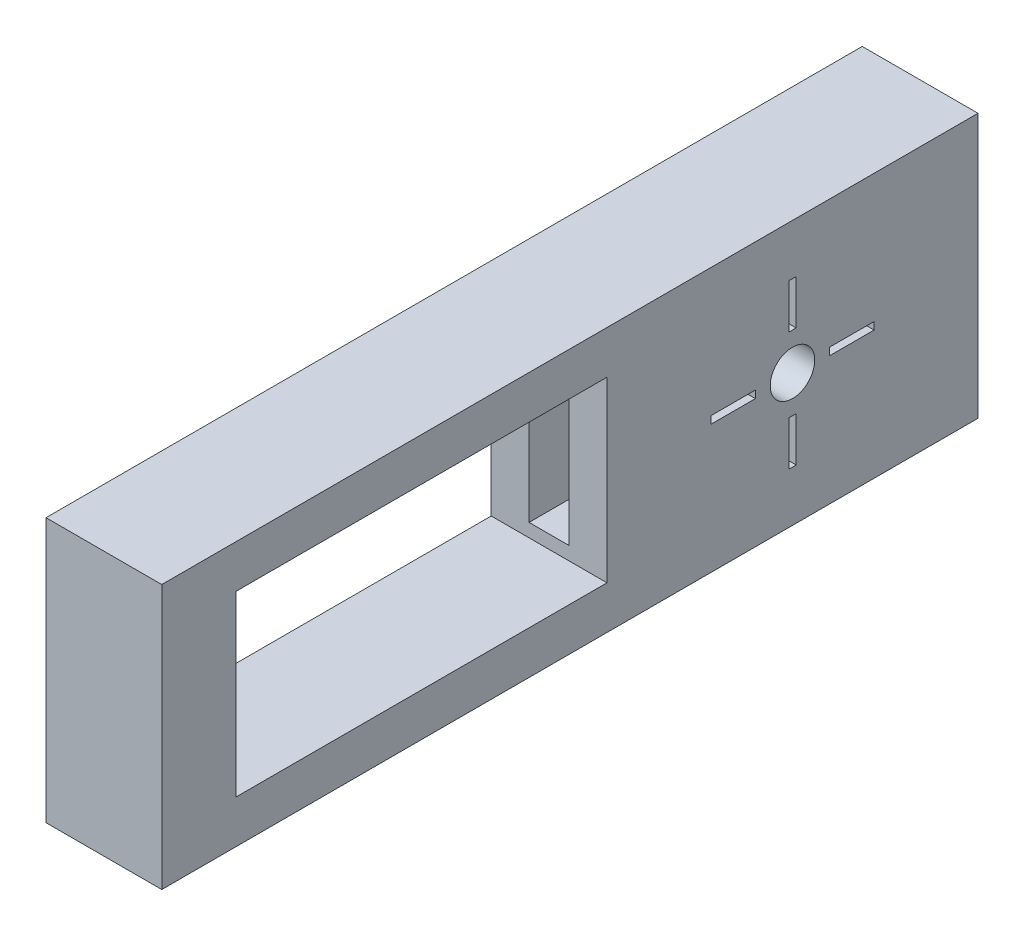
from build123d import *

# Parameters (mm, degrees)
SKETCH1_W           = 17.8
SKETCH1_H           = 25
SKETCH1_R           = 1.5
BOSS_EXTRUDE1_DEPTH = 3.9
SKETCH3_W           = 0.5
SKETCH3_H           = 3
CUT_EXTRUDE1_DEPTH  = 10
CIRPATTERN1_COUNT   = 4
SKETCH4_W           = 2.7
SKETCH4_H           = 10.2
CUT_EXTRUDE2_DEPTH  = 18
SKETCH5_W           = 2.8
SKETCH5_H           = 9
CUT_EXTRUDE3_DEPTH  = 10
SKETCH6_W           = 7.8
SKETCH6_H           = 17.8
BOSS_EXTRUDE2_DEPTH = 30
SKETCH7_W           = 25
SKETCH7_H           = 12
CUT_EXTRUDE4_DEPTH  = 30


with BuildPart() as part:
    # Sketch1 → Boss-Extrude1 (new, symmetric)
    with BuildSketch(Plane.YZ):
        Rectangle(SKETCH1_W, SKETCH1_H)
        with Locations(Location((0, 0, 0), (0, 0, 270))):
            Circle(SKETCH1_R, mode=Mode.SUBTRACT)
    extrude(amount=BOSS_EXTRUDE1_DEPTH, both=True)

    # Sketch3 → Cut-Extrude1 (cut)
    with BuildSketch(Plane(origin=(3.9, 0, 0), x_dir=(0, 0, -1), z_dir=(1, 0, 0))):
        with Locations((0, 4)):
            Rectangle(SKETCH3_W, SKETCH3_H)
    cut_extrude1 = extrude(amount=-CUT_EXTRUDE1_DEPTH, mode=Mode.SUBTRACT)

    # CirPattern1: Cut-Extrude1 ×4 about axis
    cirpattern1_axis = Axis((0, 0, 0), (1, 0, 0))
    for i in range(1, CIRPATTERN1_COUNT):
        add(cut_extrude1.rotate(cirpattern1_axis, i * 360 / CIRPATTERN1_COUNT), mode=Mode.SUBTRACT)

    # Sketch4 → Cut-Extrude2 (cut)
    with BuildSketch(Plane.XY.offset(12.5)):
        Rectangle(SKETCH4_W, SKETCH4_H)
    extrude(amount=-CUT_EXTRUDE2_DEPTH, mode=Mode.SUBTRACT)

    # Sketch5 → Cut-Extrude3 (cut)
    with BuildSketch(Plane(origin=(0, 0, -12.5), x_dir=(-1, 0, 0), z_dir=(0, 0, -1))):
        Rectangle(SKETCH5_W, SKETCH5_H)
    extrude(amount=-CUT_EXTRUDE3_DEPTH, mode=Mode.SUBTRACT)

    # Sketch6 → Boss-Extrude2 (add)
    with BuildSketch(Plane.XY.offset(12.5)):
        Rectangle(SKETCH6_W, SKETCH6_H)
    extrude(amount=BOSS_EXTRUDE2_DEPTH)

    # Sketch7 → Cut-Extrude4 (cut)
    with BuildSketch(Plane(origin=(3.9, 0, 0), x_dir=(0, 0, -1), z_dir=(1, 0, 0))):
        with Locations((-25, 0)):
            Rectangle(SKETCH7_W, SKETCH7_H)
    extrude(amount=-CUT_EXTRUDE4_DEPTH, mode=Mode.SUBTRACT)


solid = part.part
